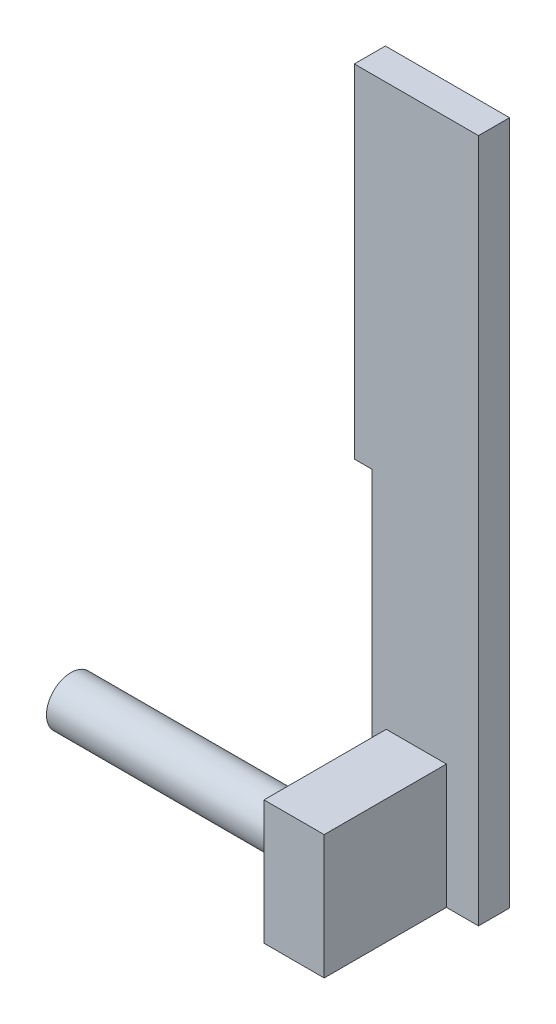
from build123d import *

# Parameters (mm, degrees)
CROQUIS1_W              = 50.8
CROQUIS1_H              = 280
SALIENTE_EXTRUIR1_DEPTH = 12.7
CROQUIS2_W              = 24.610386892
CROQUIS2_H              = 50.8
SALIENTE_EXTRUIR2_DEPTH = 50
CROQUIS4_R              = 10.011889378
SALIENTE_EXTRUIR3_DEPTH = 100
CROQUIS5_W              = 7.310893966
CROQUIS5_H              = 140
CORTAR_EXTRUIR1_DEPTH   = 187.331823837


with BuildPart() as part:
    # Croquis1 → Saliente-Extruir1 (new body)
    with BuildSketch(Plane.XY):
        Rectangle(CROQUIS1_W, CROQUIS1_H)
    extrude(amount=SALIENTE_EXTRUIR1_DEPTH)

    # Croquis2 → Saliente-Extruir2 (add)
    with BuildSketch(Plane.XY.offset(12.7)):
        with Locations((-0.031570681, -114.6)):
            Rectangle(CROQUIS2_W, CROQUIS2_H)
    extrude(amount=SALIENTE_EXTRUIR2_DEPTH)

    # Croquis4 → Saliente-Extruir3 (add)
    with BuildSketch(Plane.ZY.offset(12.336764127)):
        with Locations(Location((41.7, -114.6, 0), (0, 0, 180))):
            Circle(CROQUIS4_R)
    extrude(amount=SALIENTE_EXTRUIR3_DEPTH)

    # Croquis5 → Cortar-Extruir1 (cut, through all)
    with BuildSketch(Plane.XY.offset(12.7)):
        with Locations((-21.744553017, -70)):
            Rectangle(CROQUIS5_W, CROQUIS5_H)
    extrude(amount=-CORTAR_EXTRUIR1_DEPTH, mode=Mode.SUBTRACT)


solid = part.part
